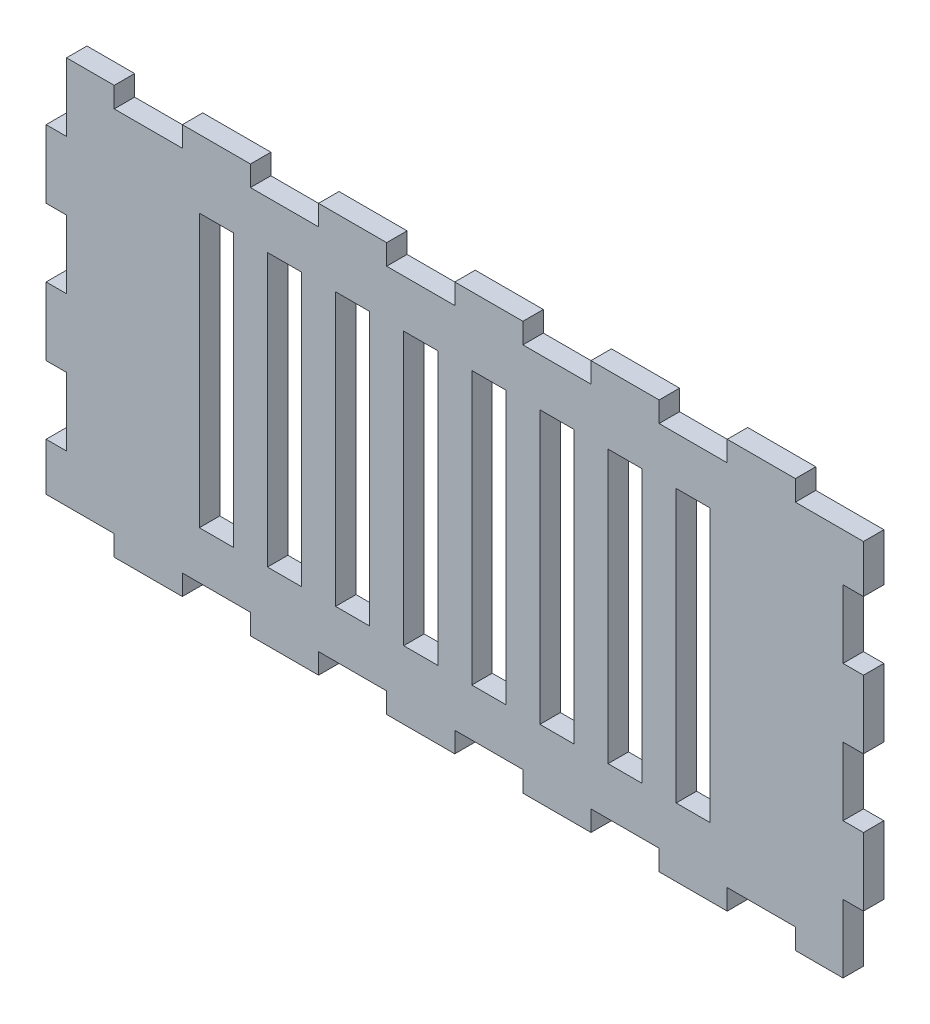
from build123d import *

# Parameters (mm, degrees)
BOSS_EXTRUDE1_DEPTH = 3
SKETCH2_W           = 5
SKETCH2_H           = 40
CUT_EXTRUDE1_DEPTH  = 10


with BuildPart() as part:
    # Sketch1 → Boss-Extrude1 (new body)
    with BuildSketch(Plane.XY):
        Polygon((110, 0), (117, 0), (117, 10), (120, 10), (120, 20), (117, 20), (117, 30), (120, 30), (120, 40), (117, 40), (117, 50), (120, 50), (120, 57), (117, 57), (110, 57), (110, 60), (100, 60), (100, 57), (90, 57), (90, 60), (80, 60), (80, 57), (70, 57), (70, 60), (60, 60), (60, 57), (50, 57), (50, 60), (40, 60), (40, 57), (30, 57), (30, 60), (20, 60), (20, 57), (10, 57), (10, 60), (3, 60), (3, 50), (0, 50), (0, 40), (3, 40), (3, 30), (0, 30), (0, 20), (3, 20), (3, 10), (0, 10), (0, 3), (3, 3), (10, 3), (10, 0), (20, 0), (20, 3), (30, 3), (30, 0), (40, 0), (40, 3), (50, 3), (50, 0), (60, 0), (60, 3), (70, 3), (70, 0), (80, 0), (80, 3), (90, 3), (90, 0), (100, 0), (100, 3), (110, 3), align=None)
    extrude(amount=BOSS_EXTRUDE1_DEPTH)

    # Sketch2 → Cut-Extrude1 (cut)
    with BuildSketch(Plane.XY.offset(3)):
        with Locations((25, 30)):
            Rectangle(SKETCH2_W, SKETCH2_H)
        with Locations((35, 30)):
            Rectangle(SKETCH2_W, SKETCH2_H)
        with Locations((45, 30)):
            Rectangle(SKETCH2_W, SKETCH2_H)
        with Locations((55, 30)):
            Rectangle(SKETCH2_W, SKETCH2_H)
        with Locations((65, 30)):
            Rectangle(SKETCH2_W, SKETCH2_H)
        with Locations((75, 30)):
            Rectangle(SKETCH2_W, SKETCH2_H)
        with Locations((85, 30)):
            Rectangle(SKETCH2_W, SKETCH2_H)
        with Locations((95, 30)):
            Rectangle(SKETCH2_W, SKETCH2_H)
    extrude(amount=-CUT_EXTRUDE1_DEPTH, mode=Mode.SUBTRACT)


solid = part.part
